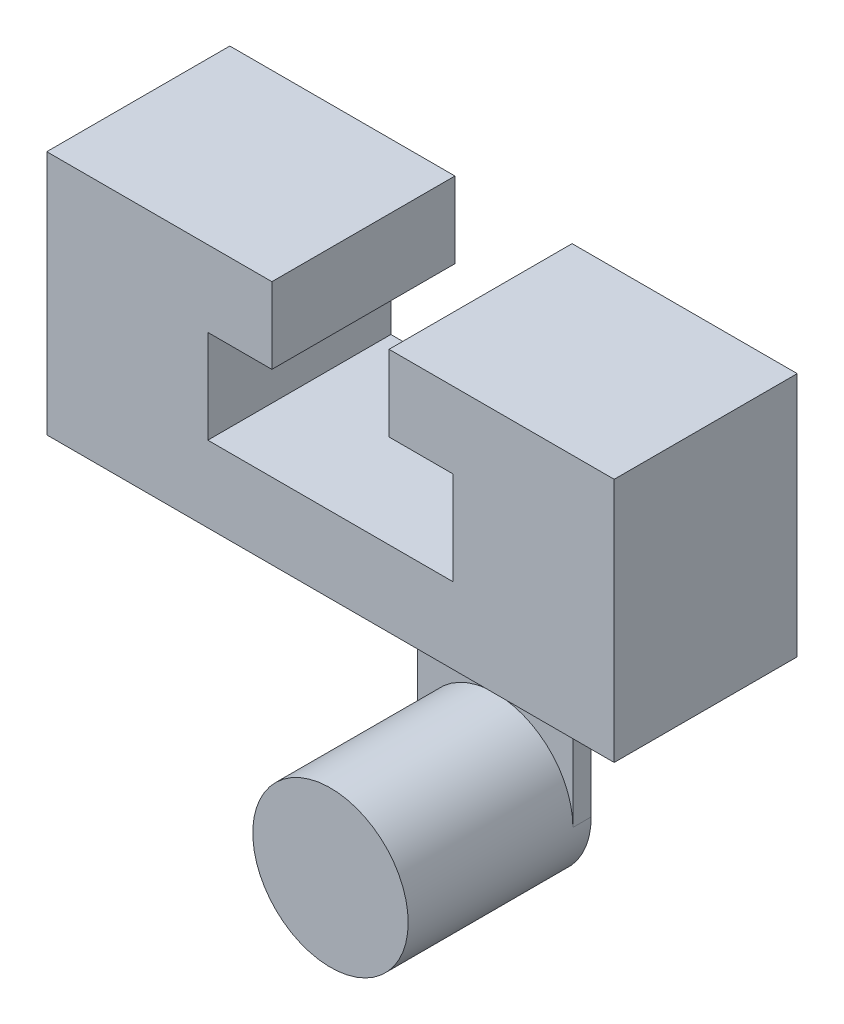
from build123d import *

# Parameters (mm, degrees)
BOSS_EXTRUDE3_DEPTH = 25.4
CUT_EXTRUDE2_DEPTH  = 94.85387731
CUT_EXTRUDE3_START  = -22.86
CUT_EXTRUDE3_DEPTH  = 22.86
SKETCH8_R           = 10.7823
BOSS_EXTRUDE4_DEPTH = 22.86


with BuildPart() as part:
    # Sketch4 → Boss-Extrude3 (new body)
    with BuildSketch(Plane.XY):
        with BuildLine():
            Line((0, 0), (28.5877, 0))
            Line((28.5877, 0), (28.5877, -33.528))
            ThreePointArc((28.5877, -33.528), (39.37, -44.3103), (50.1523, -33.528))
            Line((50.1523, -33.528), (50.1523, 0))
            Line((50.1523, 0), (78.74, 0))
            Line((78.74, 0), (78.74, 34.036))
            Line((78.74, 34.036), (0, 34.036))
            Line((0, 34.036), (0, 0))
        make_face()
    extrude(amount=BOSS_EXTRUDE3_DEPTH)

    # Sketch5 → Cut-Extrude2 (cut, through all)
    with BuildSketch(Plane.XY.offset(25.4)):
        Polygon((47.498, 23.495), (56.388, 23.495), (56.388, 10.541), (22.352, 10.541), (22.352, 23.495), (31.242, 23.495), (31.242, 34.036), (47.498, 34.036), align=None)
    extrude(amount=-CUT_EXTRUDE2_DEPTH, mode=Mode.SUBTRACT)

    # Sketch7 → Cut-Extrude3 (cut)
    with BuildSketch(Plane.XY.offset(25.4).offset(CUT_EXTRUDE3_START)):
        with BuildLine():
            Line((28.5877, 0), (50.1523, 0))
            Line((50.1523, 0), (50.1523, -33.528))
            ThreePointArc((50.1523, -33.528), (39.37, -44.3103), (28.5877, -33.528))
            Line((28.5877, -33.528), (28.5877, 0))
        make_face()
    extrude(amount=CUT_EXTRUDE3_DEPTH, mode=Mode.SUBTRACT)

    # Sketch8 → Boss-Extrude4 (add)
    with BuildSketch(Plane.XY.offset(2.54)):
        with Locations((39.37, -33.528)):
            Circle(SKETCH8_R)
    extrude(amount=BOSS_EXTRUDE4_DEPTH)


solid = part.part
